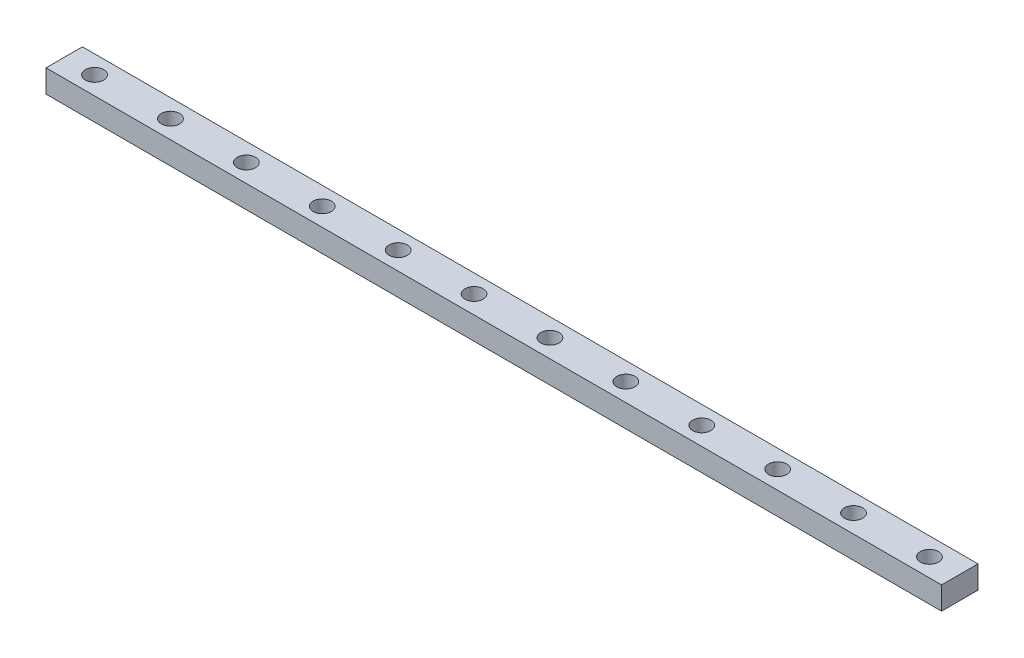
from build123d import *

# Parameters (mm, degrees)
SKETCH_2_W                   = 295
SKETCH_2_H                   = 12
EXTRUDE_1_DEPTH              = 7.5
HOLE_WIZARD_M3_1_D           = 3.5
HOLE_WIZARD_M3_1_CBORE_D     = 6
HOLE_WIZARD_M3_1_CBORE_DEPTH = 4.5
PATTERN_LINEAR_1_COUNT       = 12
PATTERN_LINEAR_1_PITCH       = 25


with BuildPart() as part:
    # 草图2 → 拉伸1 (new body)
    with BuildSketch(Plane(origin=(0, 0, 0), x_dir=(1, 0, 0), z_dir=(0, 1, 0))):
        with Locations((147.5, 0)):
            Rectangle(SKETCH_2_W, SKETCH_2_H)
    extrude(amount=EXTRUDE_1_DEPTH)

    # M3 六角凹头螺钉的柱形沉头孔1 (through all)
    with Locations(Plane(origin=(10, 7.5, 0), x_dir=(0, 0, 1), z_dir=(0, 1, 0))):
        with Locations((0, 0)):
            hole_wizard_m3_1 = CounterBoreHole(HOLE_WIZARD_M3_1_D / 2, HOLE_WIZARD_M3_1_CBORE_D / 2, HOLE_WIZARD_M3_1_CBORE_DEPTH)

    # 阵列(线性)1: M3 六角凹头螺钉的柱形沉头孔1 ×12
    with Locations(*[(i * PATTERN_LINEAR_1_PITCH, 0, 0) for i in range(1, PATTERN_LINEAR_1_COUNT)]):
        add(hole_wizard_m3_1, mode=Mode.SUBTRACT)


solid = part.part
